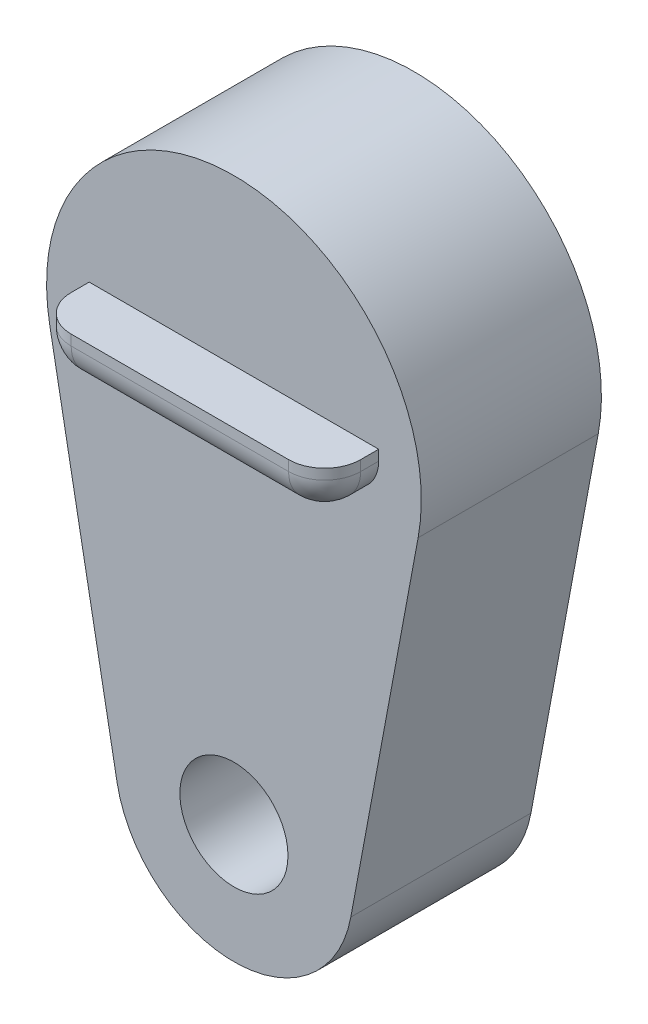
from build123d import *

# Parameters (mm, degrees)
SKETCH1_R           = 1.5
BOSS_EXTRUDE1_DEPTH = 5
BOSS_EXTRUDE2_DEPTH = 1.5
FILLET1_R           = 1


with BuildPart() as part:
    # Sketch1 → Boss-Extrude1 (new body)
    with BuildSketch(Plane.XY):
        with BuildLine():
            Line((-5.112484719, 9.45), (-3.244461456, -0.602884615))
            ThreePointArc((-3.244461456, -0.602884615), (0, -3.3), (3.244461456, -0.602884615))
            Line((3.244461456, -0.602884615), (5.112484719, 9.45))
            ThreePointArc((5.112484719, 9.45), (0, 15.6), (-5.112484719, 9.45))
        make_face()
        Circle(SKETCH1_R, mode=Mode.SUBTRACT)
    extrude(amount=BOSS_EXTRUDE1_DEPTH)

    # Sketch2 → Boss-Extrude2 (add)
    with BuildSketch(Plane.XY.offset(5)):
        with BuildLine():
            Line((-3.017059628, 9.742178321), (3.017059628, 9.742178321))
            ThreePointArc((3.017059628, 9.742178321), (3.724166409, 10.03507154), (4.017059628, 10.742178321))
            Line((4.017059628, 10.742178321), (4.017059628, 11.029697433))
            Line((4.017059628, 11.029697433), (-4.017059628, 11.029697433))
            Line((-4.017059628, 11.029697433), (-4.017059628, 10.742178321))
            ThreePointArc((-4.017059628, 10.742178321), (-3.724166409, 10.03507154), (-3.017059628, 9.742178321))
        make_face()
    extrude(amount=BOSS_EXTRUDE2_DEPTH)

    # Fillet1
    fillet1_edges = [part.edges().sort_by_distance(p)[0] for p in [
        (4.017059628, 10.885937877, 6.5),
        (-4.017059628, 10.885937877, 6.5),
        (-3.724166409, 10.03507154, 6.5),
        (0, 9.742178321, 6.5),
        (3.724166409, 10.03507154, 6.5),
    ]]
    fillet(fillet1_edges, radius=FILLET1_R)


solid = part.part
